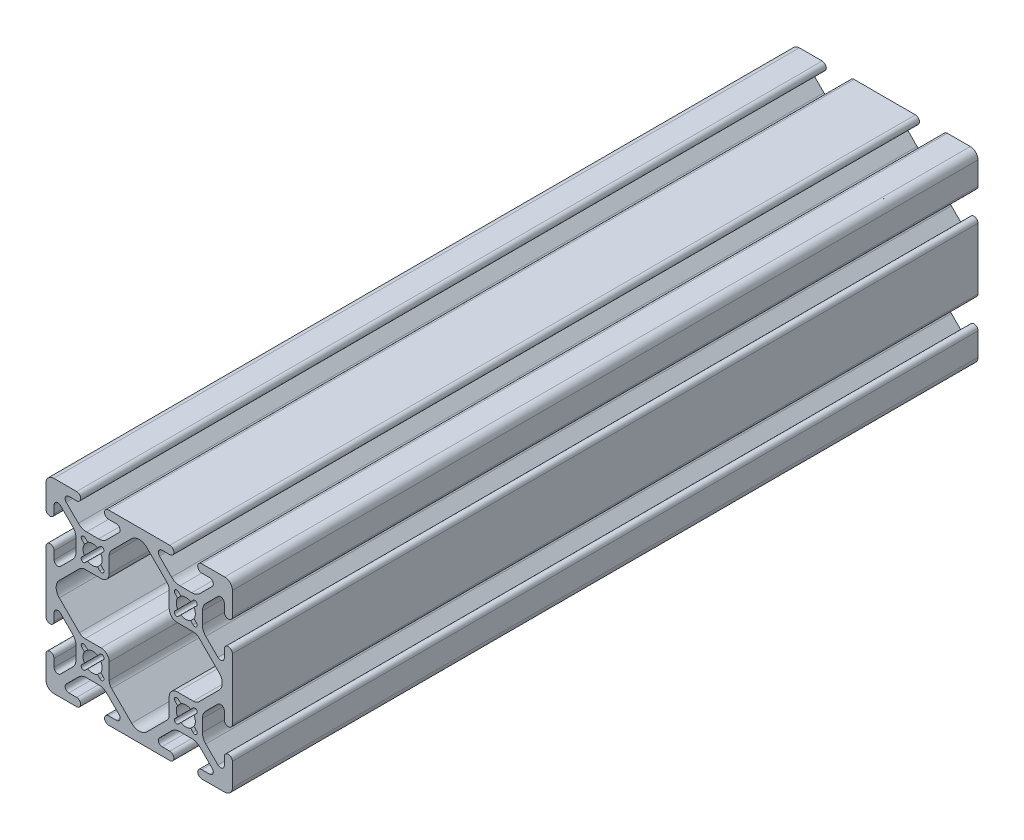
from build123d import *

# Parameters (mm, degrees)
EXTRUDE1_DEPTH = 203.2


with BuildPart() as part:
    # Sketch1 → Extrude1 (new body)
    with BuildSketch(Plane.XY):
        with BuildLine():
            Line((25.4, 17.0561), (25.4, 23.2918))
            ThreePointArc((25.4, 23.2918), (24.782522516, 24.782522516), (23.2918, 25.4))
            Line((23.2918, 25.4), (17.0561, 25.4))
            ThreePointArc((17.0561, 25.4), (15.9512, 24.2951), (17.0561, 23.1902))
            Line((17.0561, 23.1902), (19.174899798, 23.1902))
            ThreePointArc((19.174899798, 23.1902), (20.113561403, 22.563006367), (19.893320288, 21.45577951))
            Line((19.893320288, 21.45577951), (16.58464389, 18.147103113))
            ThreePointArc((16.58464389, 18.147103113), (15.554599758, 17.458849627), (14.33957986, 17.217167143))
            Line((14.33957986, 17.217167143), (11.06042014, 17.217167143))
            ThreePointArc((11.06042014, 17.217167143), (9.845400242, 17.458849627), (8.81535611, 18.147103113))
            Line((8.81535611, 18.147103113), (5.506679712, 21.45577951))
            ThreePointArc((5.506679712, 21.45577951), (5.286438597, 22.563006367), (6.225100202, 23.1902))
            Line((6.225100202, 23.1902), (8.3439, 23.1902))
            ThreePointArc((8.3439, 23.1902), (9.4488, 24.2951), (8.3439, 25.4))
            Line((8.3439, 25.4), (-8.3439, 25.4))
            ThreePointArc((-8.3439, 25.4), (-9.4488, 24.2951), (-8.3439, 23.1902))
            Line((-8.3439, 23.1902), (-6.225100202, 23.1902))
            ThreePointArc((-6.225100202, 23.1902), (-5.286438597, 22.563006367), (-5.506679712, 21.45577951))
            Line((-5.506679712, 21.45577951), (-8.81535611, 18.147103113))
            ThreePointArc((-8.81535611, 18.147103113), (-9.845400242, 17.458849627), (-11.06042014, 17.217167143))
            Line((-11.06042014, 17.217167143), (-14.33957986, 17.217167143))
            ThreePointArc((-14.33957986, 17.217167143), (-15.554599758, 17.458849627), (-16.58464389, 18.147103113))
            Line((-16.58464389, 18.147103113), (-19.893320288, 21.45577951))
            ThreePointArc((-19.893320288, 21.45577951), (-20.113561403, 22.563006367), (-19.174899798, 23.1902))
            Line((-19.174899798, 23.1902), (-17.0561, 23.1902))
            ThreePointArc((-17.0561, 23.1902), (-15.9512, 24.2951), (-17.0561, 25.4))
            Line((-17.0561, 25.4), (-23.2918, 25.4))
            ThreePointArc((-23.2918, 25.4), (-24.782522516, 24.782522516), (-25.4, 23.2918))
            Line((-25.4, 23.2918), (-25.4, 17.0561))
            ThreePointArc((-25.4, 17.0561), (-24.2951, 15.9512), (-23.1902, 17.0561))
            Line((-23.1902, 17.0561), (-23.1902, 19.174899798))
            ThreePointArc((-23.1902, 19.174899798), (-22.563006367, 20.113561403), (-21.45577951, 19.893320288))
            Line((-21.45577951, 19.893320288), (-18.147103113, 16.58464389))
            ThreePointArc((-18.147103113, 16.58464389), (-17.458849627, 15.554599758), (-17.217167143, 14.33957986))
            Line((-17.217167143, 14.33957986), (-17.217167143, 11.06042014))
            ThreePointArc((-17.217167143, 11.06042014), (-17.458849627, 9.845400242), (-18.147103113, 8.81535611))
            Line((-18.147103113, 8.81535611), (-21.45577951, 5.506679712))
            ThreePointArc((-21.45577951, 5.506679712), (-22.563006367, 5.286438597), (-23.1902, 6.225100202))
            Line((-23.1902, 6.225100202), (-23.1902, 8.3439))
            ThreePointArc((-23.1902, 8.3439), (-24.2951, 9.4488), (-25.4, 8.3439))
            Line((-25.4, 8.3439), (-25.4, -8.3439))
            ThreePointArc((-25.4, -8.3439), (-24.2951, -9.4488), (-23.1902, -8.3439))
            Line((-23.1902, -8.3439), (-23.1902, -6.225100202))
            ThreePointArc((-23.1902, -6.225100202), (-22.563006367, -5.286438597), (-21.45577951, -5.506679712))
            Line((-21.45577951, -5.506679712), (-18.147103113, -8.81535611))
            ThreePointArc((-18.147103113, -8.81535611), (-17.458849627, -9.845400242), (-17.217167143, -11.06042014))
            Line((-17.217167143, -11.06042014), (-17.217167143, -14.33957986))
            ThreePointArc((-17.217167143, -14.33957986), (-17.458849627, -15.554599758), (-18.147103113, -16.58464389))
            Line((-18.147103113, -16.58464389), (-21.45577951, -19.893320288))
            ThreePointArc((-21.45577951, -19.893320288), (-22.563006367, -20.113561403), (-23.1902, -19.174899798))
            Line((-23.1902, -19.174899798), (-23.1902, -17.0561))
            ThreePointArc((-23.1902, -17.0561), (-24.2951, -15.9512), (-25.4, -17.0561))
            Line((-25.4, -17.0561), (-25.4, -23.2918))
            ThreePointArc((-25.4, -23.2918), (-24.782522516, -24.782522516), (-23.2918, -25.4))
            Line((-23.2918, -25.4), (-17.0561, -25.4))
            ThreePointArc((-17.0561, -25.4), (-15.9512, -24.2951), (-17.0561, -23.1902))
            Line((-17.0561, -23.1902), (-19.174899798, -23.1902))
            ThreePointArc((-19.174899798, -23.1902), (-20.113561403, -22.563006367), (-19.893320288, -21.45577951))
            Line((-19.893320288, -21.45577951), (-16.58464389, -18.147103113))
            ThreePointArc((-16.58464389, -18.147103113), (-15.554599758, -17.458849627), (-14.33957986, -17.217167143))
            Line((-14.33957986, -17.217167143), (-11.06042014, -17.217167143))
            ThreePointArc((-11.06042014, -17.217167143), (-9.845400242, -17.458849627), (-8.81535611, -18.147103113))
            Line((-8.81535611, -18.147103113), (-5.506679712, -21.45577951))
            ThreePointArc((-5.506679712, -21.45577951), (-5.286438597, -22.563006367), (-6.225100202, -23.1902))
            Line((-6.225100202, -23.1902), (-8.3439, -23.1902))
            ThreePointArc((-8.3439, -23.1902), (-9.4488, -24.2951), (-8.3439, -25.4))
            Line((-8.3439, -25.4), (8.3439, -25.4))
            ThreePointArc((8.3439, -25.4), (9.4488, -24.2951), (8.3439, -23.1902))
            Line((8.3439, -23.1902), (6.225100202, -23.1902))
            ThreePointArc((6.225100202, -23.1902), (5.286438597, -22.563006367), (5.506679712, -21.45577951))
            Line((5.506679712, -21.45577951), (8.81535611, -18.147103113))
            ThreePointArc((8.81535611, -18.147103113), (9.845400242, -17.458849627), (11.06042014, -17.217167143))
            Line((11.06042014, -17.217167143), (14.33957986, -17.217167143))
            ThreePointArc((14.33957986, -17.217167143), (15.554599758, -17.458849627), (16.58464389, -18.147103113))
            Line((16.58464389, -18.147103113), (19.893320288, -21.45577951))
            ThreePointArc((19.893320288, -21.45577951), (20.113561403, -22.563006367), (19.174899798, -23.1902))
            Line((19.174899798, -23.1902), (17.0561, -23.1902))
            ThreePointArc((17.0561, -23.1902), (15.9512, -24.2951), (17.0561, -25.4))
            Line((17.0561, -25.4), (23.2918, -25.4))
            ThreePointArc((23.2918, -25.4), (24.782522516, -24.782522516), (25.4, -23.2918))
            Line((25.4, -23.2918), (25.4, -17.0561))
            ThreePointArc((25.4, -17.0561), (24.2951, -15.9512), (23.1902, -17.0561))
            Line((23.1902, -17.0561), (23.1902, -19.174899798))
            ThreePointArc((23.1902, -19.174899798), (22.563006367, -20.113561403), (21.45577951, -19.893320288))
            Line((21.45577951, -19.893320288), (18.147103113, -16.58464389))
            ThreePointArc((18.147103113, -16.58464389), (17.458849627, -15.554599758), (17.217167143, -14.33957986))
            Line((17.217167143, -14.33957986), (17.217167143, -11.06042014))
            ThreePointArc((17.217167143, -11.06042014), (17.458849627, -9.845400242), (18.147103113, -8.81535611))
            Line((18.147103113, -8.81535611), (21.45577951, -5.506679712))
            ThreePointArc((21.45577951, -5.506679712), (22.563006367, -5.286438597), (23.1902, -6.225100202))
            Line((23.1902, -6.225100202), (23.1902, -8.3439))
            ThreePointArc((23.1902, -8.3439), (24.2951, -9.4488), (25.4, -8.3439))
            Line((25.4, -8.3439), (25.4, 8.3439))
            ThreePointArc((25.4, 8.3439), (24.2951, 9.4488), (23.1902, 8.3439))
            Line((23.1902, 8.3439), (23.1902, 6.225100202))
            ThreePointArc((23.1902, 6.225100202), (22.563006367, 5.286438597), (21.45577951, 5.506679712))
            Line((21.45577951, 5.506679712), (18.147103113, 8.81535611))
            ThreePointArc((18.147103113, 8.81535611), (17.458849627, 9.845400242), (17.217167143, 11.06042014))
            Line((17.217167143, 11.06042014), (17.217167143, 14.33957986))
            ThreePointArc((17.217167143, 14.33957986), (17.458849627, 15.554599758), (18.147103113, 16.58464389))
            Line((18.147103113, 16.58464389), (21.45577951, 19.893320288))
            ThreePointArc((21.45577951, 19.893320288), (22.563006367, 20.113561403), (23.1902, 19.174899798))
            Line((23.1902, 19.174899798), (23.1902, 17.0561))
            ThreePointArc((23.1902, 17.0561), (24.2951, 15.9512), (25.4, 17.0561))
        make_face()
        with BuildLine():
            Line((-14.669151357, 15.560474191), (-14.040533428, 14.931856263))
            ThreePointArc((-14.040533428, 14.931856263), (-12.7, 15.3035), (-11.359466572, 14.931856263))
            Line((-11.359466572, 14.931856263), (-10.730848643, 15.560474191))
            ThreePointArc((-10.730848643, 15.560474191), (-9.781416761, 15.618583239), (-9.839525809, 14.669151357))
            Line((-9.839525809, 14.669151357), (-10.468143737, 14.040533428))
            ThreePointArc((-10.468143737, 14.040533428), (-10.0965, 12.7), (-10.468143737, 11.359466572))
            Line((-10.468143737, 11.359466572), (-9.839525809, 10.730848643))
            ThreePointArc((-9.839525809, 10.730848643), (-9.781416761, 9.781416761), (-10.730848643, 9.839525809))
            Line((-10.730848643, 9.839525809), (-11.359466572, 10.468143737))
            ThreePointArc((-11.359466572, 10.468143737), (-12.7, 10.0965), (-14.040533428, 10.468143737))
            Line((-14.040533428, 10.468143737), (-14.669151357, 9.839525809))
            ThreePointArc((-14.669151357, 9.839525809), (-15.618583239, 9.781416761), (-15.560474191, 10.730848643))
            Line((-15.560474191, 10.730848643), (-14.931856263, 11.359466572))
            ThreePointArc((-14.931856263, 11.359466572), (-15.3035, 12.7), (-14.931856263, 14.040533428))
            Line((-14.931856263, 14.040533428), (-15.560474191, 14.669151357))
            ThreePointArc((-15.560474191, 14.669151357), (-15.618583239, 15.618583239), (-14.669151357, 15.560474191))
        make_face(mode=Mode.SUBTRACT)
        with BuildLine():
            Line((11.359466572, 10.468143737), (10.730848643, 9.839525809))
            ThreePointArc((10.730848643, 9.839525809), (9.781416761, 9.781416761), (9.839525809, 10.730848643))
            Line((9.839525809, 10.730848643), (10.468143737, 11.359466572))
            ThreePointArc((10.468143737, 11.359466572), (10.0965, 12.7), (10.468143737, 14.040533428))
            Line((10.468143737, 14.040533428), (9.839525809, 14.669151357))
            ThreePointArc((9.839525809, 14.669151357), (9.781416761, 15.618583239), (10.730848643, 15.560474191))
            Line((10.730848643, 15.560474191), (11.359466572, 14.931856263))
            ThreePointArc((11.359466572, 14.931856263), (12.7, 15.3035), (14.040533428, 14.931856263))
            Line((14.040533428, 14.931856263), (14.669151357, 15.560474191))
            ThreePointArc((14.669151357, 15.560474191), (15.618583239, 15.618583239), (15.560474191, 14.669151357))
            Line((15.560474191, 14.669151357), (14.931856263, 14.040533428))
            ThreePointArc((14.931856263, 14.040533428), (15.3035, 12.7), (14.931856263, 11.359466572))
            Line((14.931856263, 11.359466572), (15.560474191, 10.730848643))
            ThreePointArc((15.560474191, 10.730848643), (15.618583239, 9.781416761), (14.669151357, 9.839525809))
            Line((14.669151357, 9.839525809), (14.040533428, 10.468143737))
            ThreePointArc((14.040533428, 10.468143737), (12.7, 10.0965), (11.359466572, 10.468143737))
        make_face(mode=Mode.SUBTRACT)
        with BuildLine():
            Line((-14.669151357, -9.839525809), (-14.040533428, -10.468143737))
            ThreePointArc((-14.040533428, -10.468143737), (-12.7, -10.0965), (-11.359466572, -10.468143737))
            Line((-11.359466572, -10.468143737), (-10.730848643, -9.839525809))
            ThreePointArc((-10.730848643, -9.839525809), (-9.781416761, -9.781416761), (-9.839525809, -10.730848643))
            Line((-9.839525809, -10.730848643), (-10.468143737, -11.359466572))
            ThreePointArc((-10.468143737, -11.359466572), (-10.0965, -12.7), (-10.468143737, -14.040533428))
            Line((-10.468143737, -14.040533428), (-9.839525809, -14.669151357))
            ThreePointArc((-9.839525809, -14.669151357), (-9.781416761, -15.618583239), (-10.730848643, -15.560474191))
            Line((-10.730848643, -15.560474191), (-11.359466572, -14.931856263))
            ThreePointArc((-11.359466572, -14.931856263), (-12.7, -15.3035), (-14.040533428, -14.931856263))
            Line((-14.040533428, -14.931856263), (-14.669151357, -15.560474191))
            ThreePointArc((-14.669151357, -15.560474191), (-15.618583239, -15.618583239), (-15.560474191, -14.669151357))
            Line((-15.560474191, -14.669151357), (-14.931856263, -14.040533428))
            ThreePointArc((-14.931856263, -14.040533428), (-15.3035, -12.7), (-14.931856263, -11.359466572))
            Line((-14.931856263, -11.359466572), (-15.560474191, -10.730848643))
            ThreePointArc((-15.560474191, -10.730848643), (-15.618583239, -9.781416761), (-14.669151357, -9.839525809))
        make_face(mode=Mode.SUBTRACT)
        with BuildLine():
            Line((10.730848643, -9.839525809), (11.359466572, -10.468143737))
            ThreePointArc((11.359466572, -10.468143737), (12.7, -10.0965), (14.040533428, -10.468143737))
            Line((14.040533428, -10.468143737), (14.669151357, -9.839525809))
            ThreePointArc((14.669151357, -9.839525809), (15.618583239, -9.781416761), (15.560474191, -10.730848643))
            Line((15.560474191, -10.730848643), (14.931856263, -11.359466572))
            ThreePointArc((14.931856263, -11.359466572), (15.3035, -12.7), (14.931856263, -14.040533428))
            Line((14.931856263, -14.040533428), (15.560474191, -14.669151357))
            ThreePointArc((15.560474191, -14.669151357), (15.618583239, -15.618583239), (14.669151357, -15.560474191))
            Line((14.669151357, -15.560474191), (14.040533428, -14.931856263))
            ThreePointArc((14.040533428, -14.931856263), (12.7, -15.3035), (11.359466572, -14.931856263))
            Line((11.359466572, -14.931856263), (10.730848643, -15.560474191))
            ThreePointArc((10.730848643, -15.560474191), (9.781416761, -15.618583239), (9.839525809, -14.669151357))
            Line((9.839525809, -14.669151357), (10.468143737, -14.040533428))
            ThreePointArc((10.468143737, -14.040533428), (10.0965, -12.7), (10.468143737, -11.359466572))
            Line((10.468143737, -11.359466572), (9.839525809, -10.730848643))
            ThreePointArc((9.839525809, -10.730848643), (9.781416761, -9.781416761), (10.730848643, -9.839525809))
        make_face(mode=Mode.SUBTRACT)
        with BuildLine():
            Line((7.535597422, -16.30173267), (2.058651438, -21.778678654))
            ThreePointArc((2.058651438, -21.778678654), (0, -22.6314), (-2.058651438, -21.778678654))
            Line((-2.058651438, -21.778678654), (-7.535597422, -16.30173267))
            ThreePointArc((-7.535597422, -16.30173267), (-8.014621848, -15.584821954), (-8.182832857, -14.739168105))
            Line((-8.182832857, -14.739168105), (-8.182832857, -10.392632857))
            ThreePointArc((-8.182832857, -10.392632857), (-8.830068292, -8.830068292), (-10.392632857, -8.182832857))
            Line((-10.392632857, -8.182832857), (-14.739168105, -8.182832857))
            ThreePointArc((-14.739168105, -8.182832857), (-15.584821954, -8.014621848), (-16.30173267, -7.535597422))
            Line((-16.30173267, -7.535597422), (-21.778678654, -2.058651438))
            ThreePointArc((-21.778678654, -2.058651438), (-22.6314, 0), (-21.778678654, 2.058651438))
            Line((-21.778678654, 2.058651438), (-16.30173267, 7.535597422))
            ThreePointArc((-16.30173267, 7.535597422), (-15.584821954, 8.014621848), (-14.739168105, 8.182832857))
            Line((-14.739168105, 8.182832857), (-10.392632857, 8.182832857))
            ThreePointArc((-10.392632857, 8.182832857), (-8.830068292, 8.830068292), (-8.182832857, 10.392632857))
            Line((-8.182832857, 10.392632857), (-8.182832857, 14.739168105))
            ThreePointArc((-8.182832857, 14.739168105), (-8.014621848, 15.584821954), (-7.535597422, 16.30173267))
            Line((-7.535597422, 16.30173267), (-2.058651438, 21.778678654))
            ThreePointArc((-2.058651438, 21.778678654), (0, 22.6314), (2.058651438, 21.778678654))
            Line((2.058651438, 21.778678654), (7.535597422, 16.30173267))
            ThreePointArc((7.535597422, 16.30173267), (8.014621848, 15.584821954), (8.182832857, 14.739168105))
            Line((8.182832857, 14.739168105), (8.182832857, 10.392632857))
            ThreePointArc((8.182832857, 10.392632857), (8.830068292, 8.830068292), (10.392632857, 8.182832857))
            Line((10.392632857, 8.182832857), (14.739168105, 8.182832857))
            ThreePointArc((14.739168105, 8.182832857), (15.584821954, 8.014621848), (16.30173267, 7.535597422))
            Line((16.30173267, 7.535597422), (21.778678654, 2.058651438))
            ThreePointArc((21.778678654, 2.058651438), (22.6314, 0), (21.778678654, -2.058651438))
            Line((21.778678654, -2.058651438), (16.30173267, -7.535597422))
            ThreePointArc((16.30173267, -7.535597422), (15.584821954, -8.014621848), (14.739168105, -8.182832857))
            Line((14.739168105, -8.182832857), (10.392632857, -8.182832857))
            ThreePointArc((10.392632857, -8.182832857), (8.830068292, -8.830068292), (8.182832857, -10.392632857))
            Line((8.182832857, -10.392632857), (8.182832857, -14.739168105))
            ThreePointArc((8.182832857, -14.739168105), (8.014621848, -15.584821954), (7.535597422, -16.30173267))
        make_face(mode=Mode.SUBTRACT)
    extrude(amount=-EXTRUDE1_DEPTH)


solid = part.part
